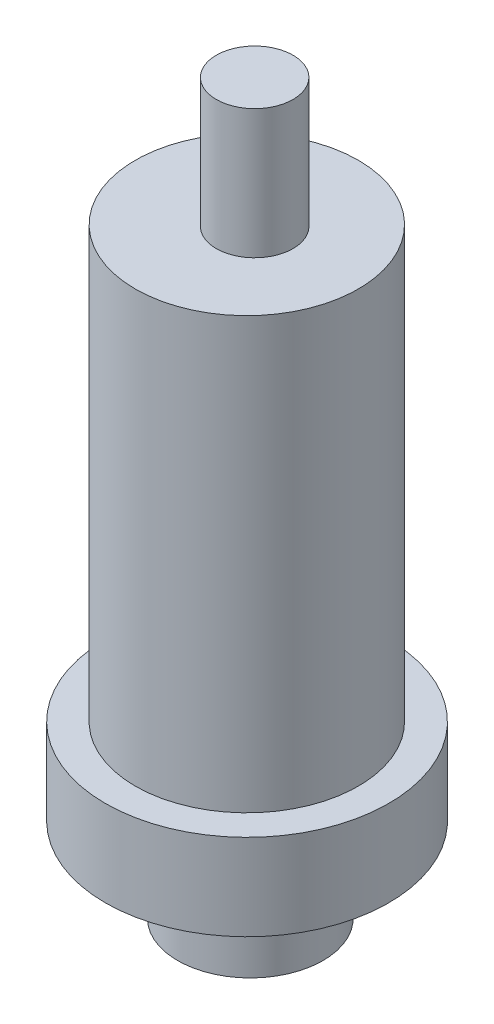
from build123d import *

# Parameters (mm, degrees)
SKETCH1_R           = 16.457903775
BOSS_EXTRUDE1_DEPTH = 10
SKETCH2_R           = 12.953549685
BOSS_EXTRUDE2_DEPTH = 50
SKETCH3_R           = 8.446337145
BOSS_EXTRUDE3_DEPTH = 10
SKETCH4_R           = 4.456251168
BOSS_EXTRUDE4_DEPTH = 15


with BuildPart() as part:
    # Sketch1 → Boss-Extrude1 (new body)
    with BuildSketch(Plane(origin=(0, 0, 0), x_dir=(1, 0, 0), z_dir=(0, 1, 0))):
        with Locations(Location((0, 1.800880605, 0), (0, 0, 270))):
            Circle(SKETCH1_R)
    extrude(amount=BOSS_EXTRUDE1_DEPTH)

    # Sketch2 → Boss-Extrude2 (add)
    with BuildSketch(Plane(origin=(0, 10, 0), x_dir=(1, 0, 0), z_dir=(0, 1, 0))):
        with Locations(Location((0, 1.773449881, 0), (0, 0, 270))):
            Circle(SKETCH2_R)
    extrude(amount=BOSS_EXTRUDE2_DEPTH)

    # Sketch3 → Boss-Extrude3 (add)
    with BuildSketch(Plane(origin=(0, 0, 0), x_dir=(-1, 0, 0), z_dir=(0, -1, 0))):
        with Locations(Location((0, 2.178892035, 0), (0, 0, 90))):
            Circle(SKETCH3_R)
    extrude(amount=BOSS_EXTRUDE3_DEPTH)

    # Sketch4 → Boss-Extrude4 (add)
    with BuildSketch(Plane(origin=(0, 60, 0), x_dir=(1, 0, 0), z_dir=(0, 1, 0))):
        with Locations(Location((0.642895669, 2.041784186, 0), (0, 0, 270))):
            Circle(SKETCH4_R)
    extrude(amount=BOSS_EXTRUDE4_DEPTH)


solid = part.part
